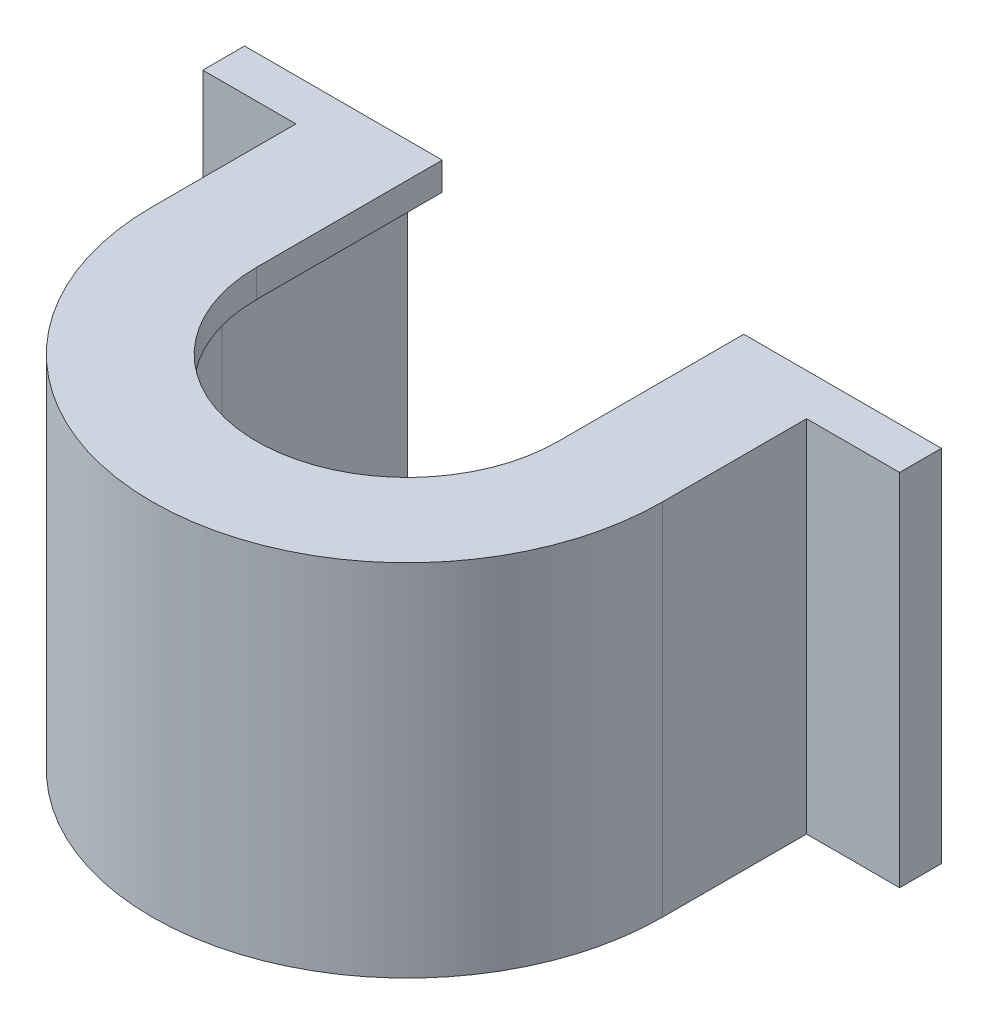
from build123d import *

# Parameters (mm, degrees)
BOSS_EXTRUDE1_DEPTH = 20
BOSS_EXTRUDE2_DEPTH = 12.7
BOSS_EXTRUDE3_DEPTH = 2
SKETCH4_W           = 52.357488091
SKETCH4_H           = 8.89
CUT_EXTRUDE1_DEPTH  = 22


with BuildPart() as part:
    # Sketch1 → Boss-Extrude1 (new body)
    with BuildSketch(Plane(origin=(0, 0, 0), x_dir=(1, 0, 0), z_dir=(0, 1, 0))):
        with BuildLine():
            Line((-18.32, 0), (-18.32, 2.075569274))
            Line((-18.32, 2.075569274), (-18.32, 10.32))
            Line((-18.32, 10.32), (-25, 10.32))
            Line((-25, 10.32), (-25, 13.32))
            Line((-25, 13.32), (-13.32, 13.32))
            Line((-13.32, 13.32), (-13.32, 0))
            ThreePointArc((-13.32, 0), (0, -13.32), (13.32, 0))
            Line((13.32, 0), (13.32, 13.32))
            Line((13.32, 13.32), (25, 13.32))
            Line((25, 13.32), (25, 10.32))
            Line((25, 10.32), (18.32, 10.32))
            Line((18.32, 10.32), (18.32, 1.685292353))
            Line((18.32, 1.685292353), (18.32, 0))
            ThreePointArc((18.32, 0), (0, -18.32), (-18.32, 0))
        make_face()
    extrude(amount=BOSS_EXTRUDE1_DEPTH)

    # Sketch2 → Boss-Extrude2 (add)
    with BuildSketch(Plane(origin=(0, 20, 0), x_dir=(1, 0, 0), z_dir=(0, 1, 0))):
        with BuildLine():
            Line((-18.32, 10.32), (-18.32, 0))
            ThreePointArc((-18.32, 0), (0, -18.32), (18.32, 0))
            Line((18.32, 0), (18.32, 10.32))
            Line((18.32, 10.32), (25, 10.32))
            Line((25, 10.32), (25, 13.32))
            Line((25, 13.32), (13.32, 13.32))
            Line((13.32, 13.32), (13.32, 0))
            ThreePointArc((13.32, 0), (0, -13.32), (-13.32, 0))
            Line((-13.32, 0), (-13.32, 13.32))
            Line((-13.32, 13.32), (-25, 13.32))
            Line((-25, 13.32), (-25, 10.32))
            Line((-25, 10.32), (-18.32, 10.32))
        make_face()
    extrude(amount=BOSS_EXTRUDE2_DEPTH)

    # Sketch3 → Boss-Extrude3 (add)
    with BuildSketch(Plane(origin=(0, 32.7, 0), x_dir=(1, 0, 0), z_dir=(0, 1, 0))):
        with BuildLine():
            Line((-10.82, 13.32), (-13.32, 13.32))
            Line((-13.32, 13.32), (-13.32, 0))
            ThreePointArc((-13.32, 0), (0, -13.32), (13.32, 0))
            Line((13.32, 0), (13.32, 13.32))
            Line((13.32, 13.32), (10.82, 13.32))
            Line((10.82, 13.32), (10.82, 0))
            ThreePointArc((10.82, 0), (0, -10.82), (-10.82, 0))
            Line((-10.82, 0), (-10.82, 13.32))
        make_face()
        with BuildLine():
            Line((-25, 13.32), (-25, 10.32))
            Line((-25, 10.32), (-18.32, 10.32))
            Line((-18.32, 10.32), (-18.32, 0))
            ThreePointArc((-18.32, 0), (0, -18.32), (18.32, 0))
            Line((18.32, 0), (18.32, 10.32))
            Line((18.32, 10.32), (25, 10.32))
            Line((25, 10.32), (25, 13.32))
            Line((25, 13.32), (13.32, 13.32))
            Line((13.32, 13.32), (13.32, 0))
            ThreePointArc((13.32, 0), (0, -13.32), (-13.32, 0))
            Line((-13.32, 0), (-13.32, 13.32))
            Line((-13.32, 13.32), (-25, 13.32))
        make_face()
    extrude(amount=BOSS_EXTRUDE3_DEPTH)

    # Sketch4 → Cut-Extrude1 (cut, symmetric)
    with BuildSketch(Plane.XY):
        with Locations((1.178744046, 4.445)):
            Rectangle(SKETCH4_W, SKETCH4_H)
    extrude(amount=CUT_EXTRUDE1_DEPTH, both=True, mode=Mode.SUBTRACT)


solid = part.part
